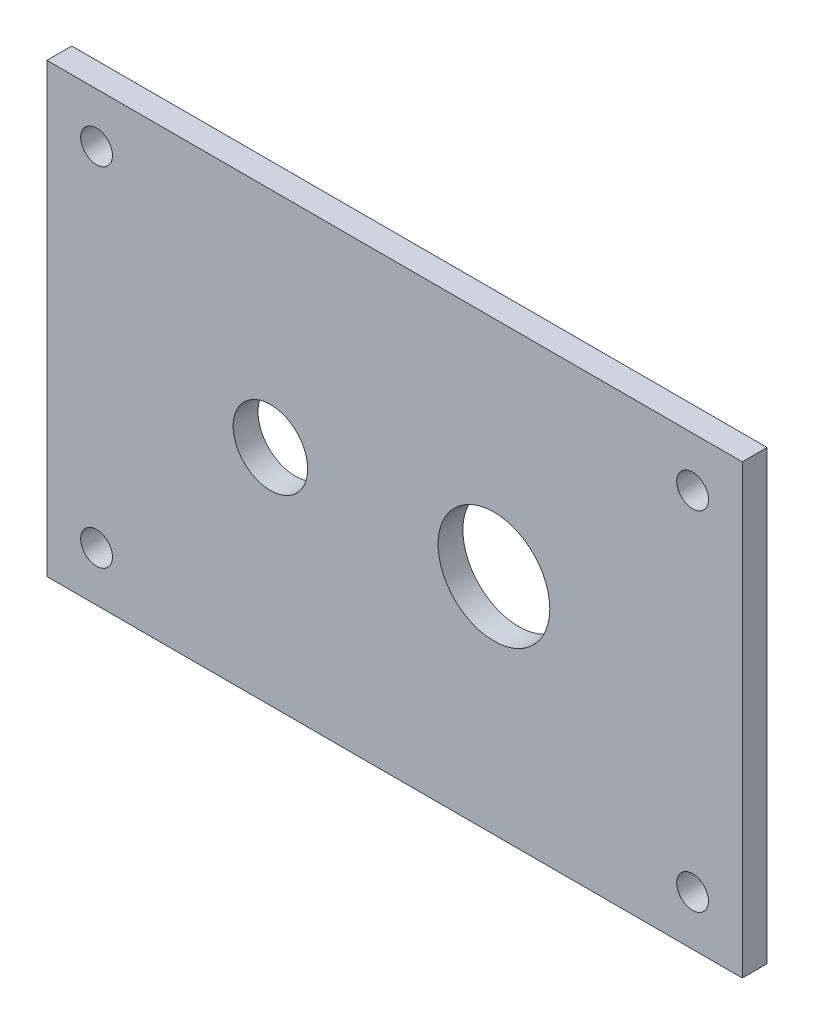
from build123d import *

# Parameters (mm, degrees)
SKETCH1_W           = 177.8
SKETCH1_H           = 114.3
SKETCH1_R           = 14.2875
SKETCH1_R_2         = 9.525
SKETCH1_R_3         = 4.064
BOSS_EXTRUDE1_DEPTH = 3.175


with BuildPart() as part:
    # Sketch1 → Boss-Extrude1 (new, symmetric)
    with BuildSketch(Plane.XY):
        Rectangle(SKETCH1_W, SKETCH1_H)
        with Locations((25.4, 0)):
            Circle(SKETCH1_R, mode=Mode.SUBTRACT)
        with Locations((-31.75, 0)):
            Circle(SKETCH1_R_2, mode=Mode.SUBTRACT)
        with Locations((-76.2, 44.45)):
            Circle(SKETCH1_R_3, mode=Mode.SUBTRACT)
        with Locations(Location((-76.2, -44.45, 0), (0, 0, 180))):
            Circle(SKETCH1_R_3, mode=Mode.SUBTRACT)
        with Locations(Location((76.2, 44.45, 0), (0, 0, 180))):
            Circle(SKETCH1_R_3, mode=Mode.SUBTRACT)
        with Locations((76.2, -44.45)):
            Circle(SKETCH1_R_3, mode=Mode.SUBTRACT)
    extrude(amount=BOSS_EXTRUDE1_DEPTH, both=True)


solid = part.part
